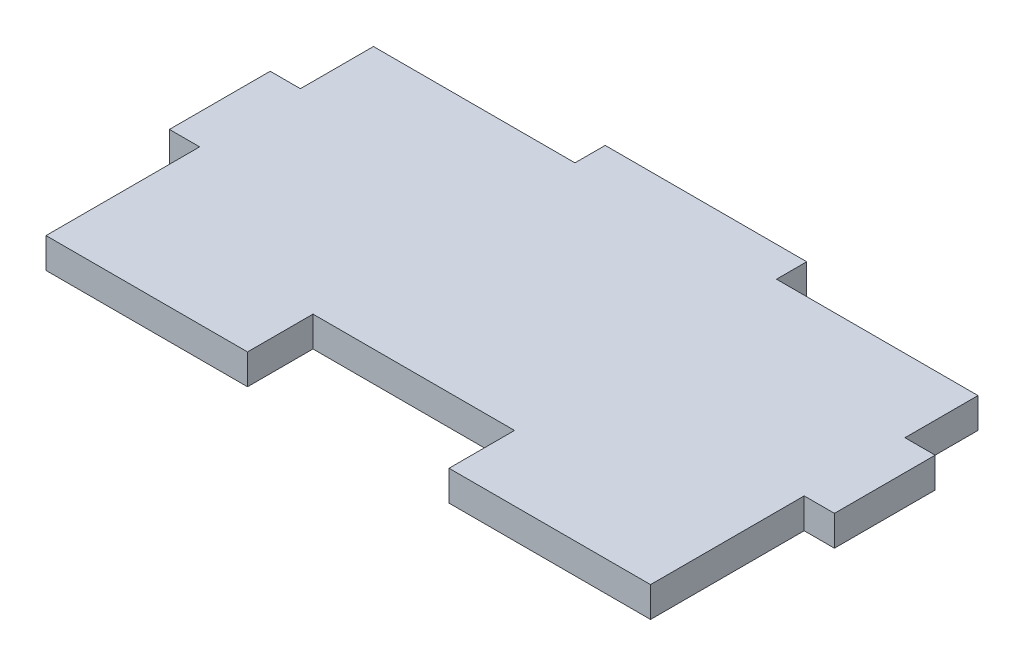
from build123d import *

# Parameters (mm, degrees)
SKETCH2_W           = 60
SKETCH2_H           = 35.5
BOSS_EXTRUDE1_DEPTH = 3
SKETCH3_W           = 3
SKETCH3_H           = 10
BOSS_EXTRUDE2_DEPTH = 3
SKETCH4_W           = 20
SKETCH4_H           = 3
CUT_EXTRUDE2_DEPTH  = 3
SKETCH5_W           = 20
SKETCH5_H           = 6.5
CUT_EXTRUDE3_DEPTH  = 10


with BuildPart() as part:
    # Sketch2 → Boss-Extrude1 (new body)
    with BuildSketch(Plane(origin=(0, 0, 0), x_dir=(1, 0, 0), z_dir=(0, 1, 0))):
        Rectangle(SKETCH2_W, SKETCH2_H)
    extrude(amount=BOSS_EXTRUDE1_DEPTH)

    # Sketch3 → Boss-Extrude2 (add)
    with BuildSketch(Plane(origin=(0, 0, 0), x_dir=(1, 0, 0), z_dir=(0, 1, 0))):
        with Locations((-31.5, 2.5)):
            Rectangle(SKETCH3_W, SKETCH3_H)
        with Locations((31.5, 2.5)):
            Rectangle(SKETCH3_W, SKETCH3_H)
    extrude(amount=BOSS_EXTRUDE2_DEPTH)

    # Sketch4 → Cut-Extrude2 (cut)
    with BuildSketch(Plane(origin=(0, 3, 0), x_dir=(1, 0, 0), z_dir=(0, 1, 0))):
        with Locations((-20, 16.25)):
            Rectangle(SKETCH4_W, SKETCH4_H)
        with Locations((20, 16.25)):
            Rectangle(SKETCH4_W, SKETCH4_H)
    extrude(amount=-CUT_EXTRUDE2_DEPTH, mode=Mode.SUBTRACT)

    # Sketch5 → Cut-Extrude3 (cut)
    with BuildSketch(Plane(origin=(0, 3, 0), x_dir=(1, 0, 0), z_dir=(0, 1, 0))):
        with Locations((0, -14.5)):
            Rectangle(SKETCH5_W, SKETCH5_H)
    extrude(amount=-CUT_EXTRUDE3_DEPTH, mode=Mode.SUBTRACT)


solid = part.part
